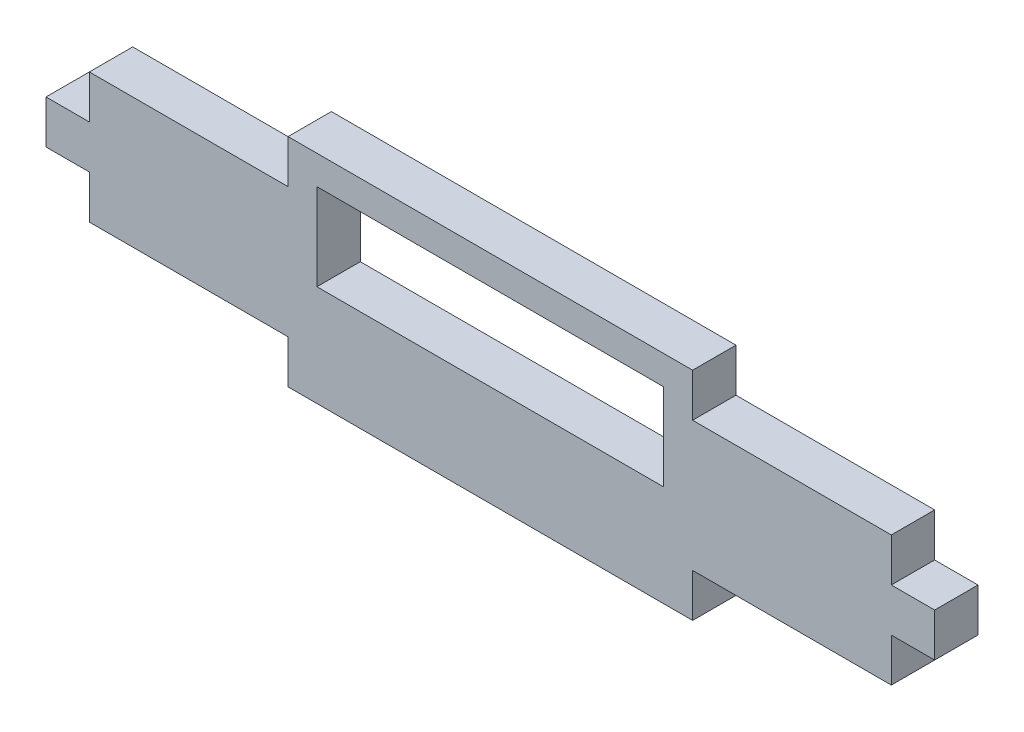
from build123d import *

# Parameters (mm, degrees)
SKETCH1_W           = 24
SKETCH1_H           = 6
BOSS_EXTRUDE1_DEPTH = 3


with BuildPart() as part:
    # Sketch1 → Boss-Extrude1 (new body)
    with BuildSketch(Plane.XY):
        Polygon((-14, -7.5), (14, -7.5), (14, -4.5), (27.75, -4.5), (27.75, -1.5), (30.75, -1.5), (30.75, 1.5), (27.75, 1.5), (27.75, 4.5), (14, 4.5), (14, 7.5), (-14, 7.5), (-14, 4.5), (-27.75, 4.5), (-27.75, 1.5), (-30.75, 1.5), (-30.75, -1.5), (-27.75, -1.5), (-27.75, -4.5), (-14, -4.5), align=None)
        with Locations((0, 2.5)):
            Rectangle(SKETCH1_W, SKETCH1_H, mode=Mode.SUBTRACT)
    extrude(amount=BOSS_EXTRUDE1_DEPTH)


solid = part.part
